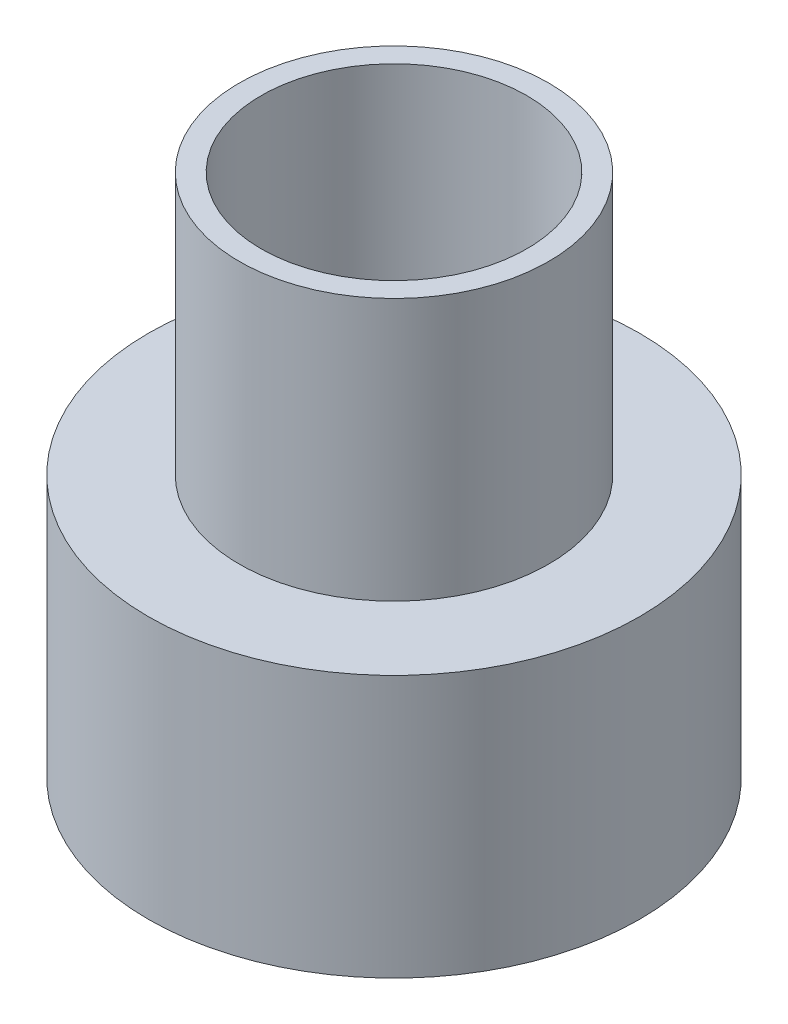
from build123d import *


with BuildPart() as part:
    # Sketch1 → Revolve1 (revolve)
    with BuildSketch(Plane.XY, mode=Mode.PRIVATE) as revolve1_sk:
        Polygon((-22.479, 38.1), (-22.479, 0), (-35.687, 0), (-35.687, -38.1), (-32.512, -38.1), (-32.512, -3.175), (-25.654, -3.175), (-25.654, -8.255), (-22.479, -8.255), (-22.479, -3.175), (-19.304, -3.175), (-19.304, 38.1), align=None)
    revolve(revolve1_sk.sketch.rotate(Axis((0, -55.839414215, 0), (0, 1, 0)), 270), axis=Axis((0, -55.839414215, 0), (0, 1, 0)))


solid = part.part
